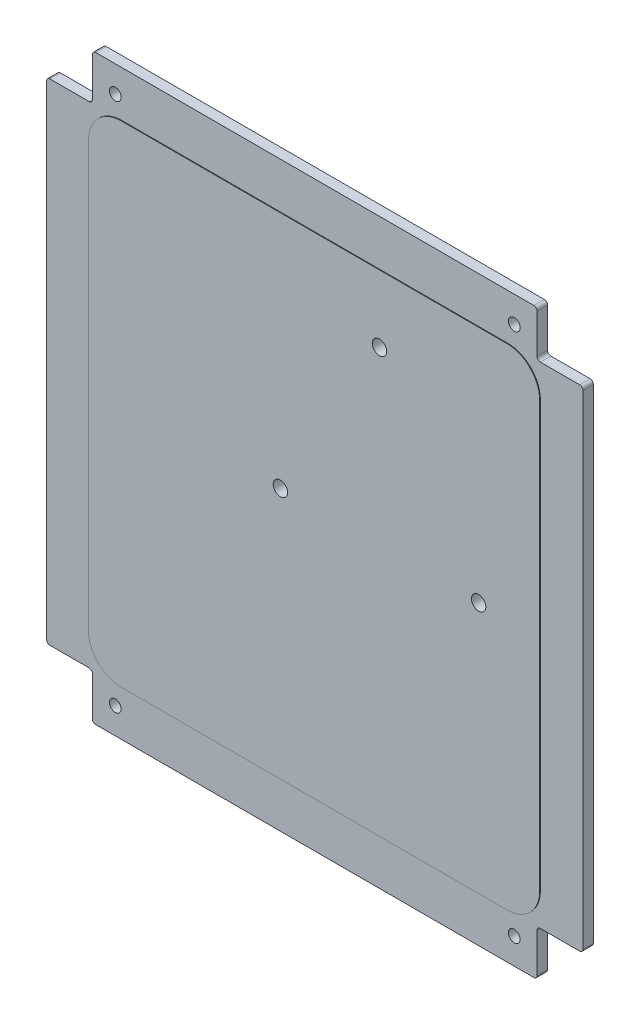
from build123d import *

# Parameters (mm, degrees)
BOSS_EXTRUDE1_DEPTH              = 1.6
BOSS_EXTRUDE2_DEPTH              = 0.1
M1_6_HOLE1_FIXINGSTRUCTURE_D     = 1.8
M1_6_HOLE1_FIXINGSTRUCTURE_DEPTH = 200
M1_6_HOLE1_FIXINGSTRUCTURE_TIP   = 0.540774557
SKETCH4_R                        = 1.1
CUT_EXTRUDE1_DEPTH               = 1.7


with BuildPart() as part:
    # Sketch1 → Boss-Extrude1 (new body)
    with BuildSketch(Plane.XY):
        with BuildLine():
            Line((-34, 44), (-34, 38))
            ThreePointArc((-34, 38), (-34.146446609, 37.646446609), (-34.5, 37.5))
            Line((-34.5, 37.5), (-40.5, 37.5))
            ThreePointArc((-40.5, 37.5), (-40.853553391, 37.353553391), (-41, 37))
            Line((-41, 37), (-41, -37))
            ThreePointArc((-41, -37), (-40.853553391, -37.353553391), (-40.5, -37.5))
            Line((-40.5, -37.5), (-34.5, -37.5))
            ThreePointArc((-34.5, -37.5), (-34.146446609, -37.646446609), (-34, -38))
            Line((-34, -38), (-34, -44))
            ThreePointArc((-34, -44), (-33.853553391, -44.353553391), (-33.5, -44.5))
            Line((-33.5, -44.5), (33.5, -44.5))
            ThreePointArc((33.5, -44.5), (33.853553391, -44.353553391), (34, -44))
            Line((34, -44), (34, -38))
            ThreePointArc((34, -38), (34.146446609, -37.646446609), (34.5, -37.5))
            Line((34.5, -37.5), (40.5, -37.5))
            ThreePointArc((40.5, -37.5), (40.853553391, -37.353553391), (41, -37))
            Line((41, -37), (41, 37))
            ThreePointArc((41, 37), (40.853553391, 37.353553391), (40.5, 37.5))
            Line((40.5, 37.5), (34.5, 37.5))
            ThreePointArc((34.5, 37.5), (34.146446609, 37.646446609), (34, 38))
            Line((34, 38), (34, 44))
            ThreePointArc((34, 44), (33.853553391, 44.353553391), (33.5, 44.5))
            Line((33.5, 44.5), (-33.5, 44.5))
            ThreePointArc((-33.5, 44.5), (-33.853553391, 44.353553391), (-34, 44))
        make_face()
    extrude(amount=BOSS_EXTRUDE1_DEPTH)

    # Esboço1 → Boss-Extrude2 (add)
    with BuildSketch(Plane.XY.offset(1.6)):
        with BuildLine():
            Line((-29.5, -37.5), (29.5, -37.5))
            ThreePointArc((29.5, -37.5), (33.035533906, -36.035533906), (34.5, -32.5))
            Line((34.5, -32.5), (34.5, 32.5))
            ThreePointArc((34.5, 32.5), (33.035533906, 36.035533906), (29.5, 37.5))
            Line((29.5, 37.5), (-29.5, 37.5))
            ThreePointArc((-29.5, 37.5), (-33.035533906, 36.035533906), (-34.5, 32.5))
            Line((-34.5, 32.5), (-34.5, -32.5))
            ThreePointArc((-34.5, -32.5), (-33.035533906, -36.035533906), (-29.5, -37.5))
        make_face()
    extrude(amount=BOSS_EXTRUDE2_DEPTH)

    # M1.6 Hole1-FixingStructure
    with Locations(Plane(origin=(0, 0, 0), x_dir=(-1, 0, 0), z_dir=(0, 0, -1))):
        with Locations((-30.5, 40.5), (30.5, 40.5), (-30.5, -40.5), (30.5, -40.5)):
            Hole(M1_6_HOLE1_FIXINGSTRUCTURE_D / 2, depth=M1_6_HOLE1_FIXINGSTRUCTURE_DEPTH)
            with Locations((0, 0, -(M1_6_HOLE1_FIXINGSTRUCTURE_DEPTH + M1_6_HOLE1_FIXINGSTRUCTURE_TIP / 2))):  # 118° drill point
                Cone(0, M1_6_HOLE1_FIXINGSTRUCTURE_D / 2, M1_6_HOLE1_FIXINGSTRUCTURE_TIP, mode=Mode.SUBTRACT)

    # Sketch4 → Cut-Extrude1 (cut)
    with BuildSketch(Plane.XY.offset(1.7)):
        with Locations((25.155444566, 1)):
            Circle(SKETCH4_R)
        with Locations((10, 27.25)):
            Circle(SKETCH4_R)
        with Locations((-5.155444566, 1)):
            Circle(SKETCH4_R)
    extrude(amount=-CUT_EXTRUDE1_DEPTH, mode=Mode.SUBTRACT)


solid = part.part
